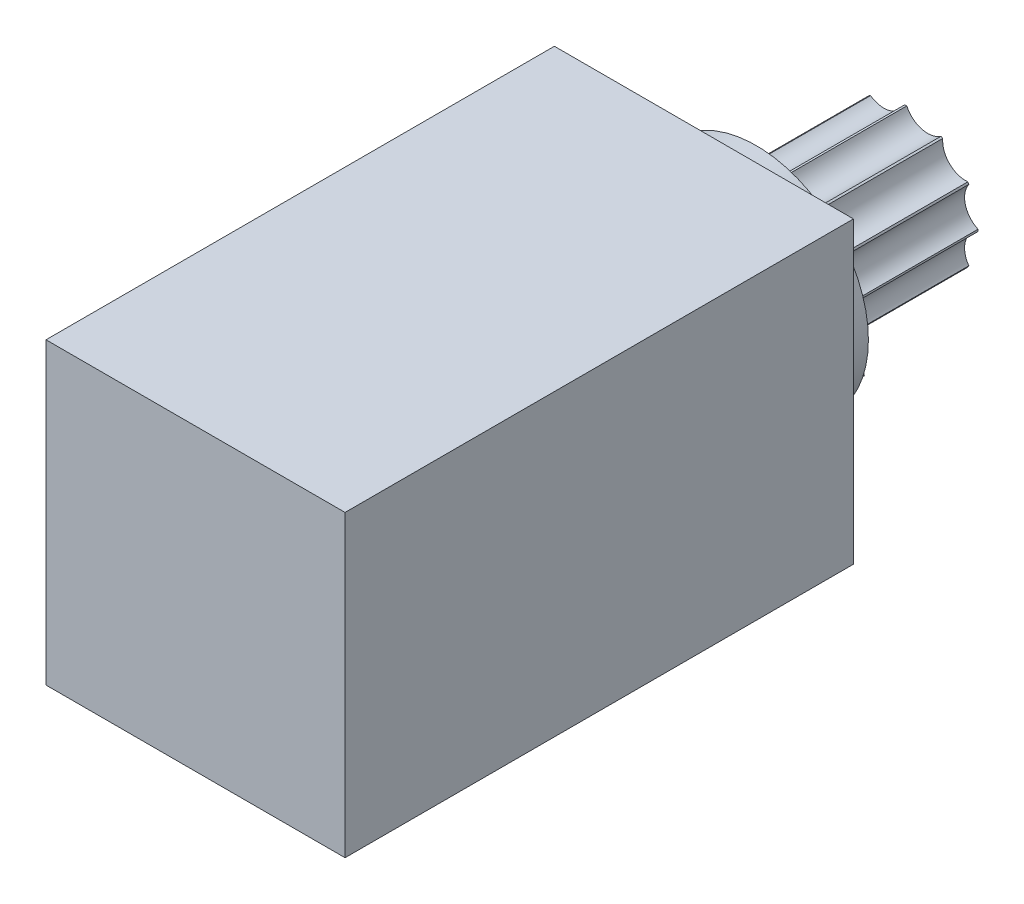
from build123d import *

# Parameters (mm, degrees)
CROQUIS1_R              = 10
SALIENTE_EXTRUIR1_DEPTH = 20
CROQUIS2_R              = 10
CORTAR_EXTRUIR2_DEPTH   = 20
CROQUIS3_R              = 15
SALIENTE_EXTRUIR2_DEPTH = 5
SALIENTE_EXTRUIR3_START = 5
SALIENTE_EXTRUIR3_DEPTH = 5
CROQUIS6_W              = 40
CROQUIS6_H              = 40
SALIENTE_EXTRUIR4_DEPTH = 70
CROQUIS8_W              = 40
CROQUIS8_H              = 40
CROQUIS8_R              = 11.25
CORTAR_EXTRUIR3_DEPTH   = 2


with BuildPart() as part:
    # Croquis1 → Saliente-Extruir1 (new body)
    with BuildSketch(Plane.XY):
        Circle(CROQUIS1_R)
    extrude(amount=SALIENTE_EXTRUIR1_DEPTH)

    # Croquis2 → Cortar-Extruir2 (cut)
    with BuildSketch(Plane(origin=(0, 0, 0), x_dir=(-1, 0, 0), z_dir=(0, 0, -1))):
        Circle(CROQUIS2_R)
        with BuildLine():
            Line((0.133032496, 9.658342122), (-0.133032496, 9.658342122))
            ThreePointArc((-0.133032496, 9.658342122), (-2.135257122, 7.968888067), (-4.71396154, 8.430885884))
            Line((-4.71396154, 8.430885884), (-4.944380582, 8.297853388))
            ThreePointArc((-4.944380582, 8.297853388), (-5.833630945, 5.833630945), (-8.297853388, 4.944380582))
            Line((-8.297853388, 4.944380582), (-8.430885884, 4.71396154))
            ThreePointArc((-8.430885884, 4.71396154), (-7.968888067, 2.135257122), (-9.658342122, 0.133032496))
            Line((-9.658342122, 0.133032496), (-9.658342122, -0.133032496))
            ThreePointArc((-9.658342122, -0.133032496), (-7.968888067, -2.135257122), (-8.430885884, -4.71396154))
            Line((-8.430885884, -4.71396154), (-8.297853388, -4.944380582))
            ThreePointArc((-8.297853388, -4.944380582), (-5.833630945, -5.833630945), (-4.944380582, -8.297853388))
            Line((-4.944380582, -8.297853388), (-4.71396154, -8.430885884))
            ThreePointArc((-4.71396154, -8.430885884), (-2.135257122, -7.968888067), (-0.133032496, -9.658342122))
            Line((-0.133032496, -9.658342122), (0.133032496, -9.658342122))
            ThreePointArc((0.133032496, -9.658342122), (2.135257122, -7.968888067), (4.71396154, -8.430885884))
            Line((4.71396154, -8.430885884), (4.944380582, -8.297853388))
            ThreePointArc((4.944380582, -8.297853388), (5.833630945, -5.833630945), (8.297853388, -4.944380582))
            Line((8.297853388, -4.944380582), (8.430885884, -4.71396154))
            ThreePointArc((8.430885884, -4.71396154), (7.968888067, -2.135257122), (9.658342122, -0.133032496))
            Line((9.658342122, -0.133032496), (9.658342122, 0.133032496))
            ThreePointArc((9.658342122, 0.133032496), (7.968888067, 2.135257122), (8.430885884, 4.71396154))
            Line((8.430885884, 4.71396154), (8.297853388, 4.944380582))
            ThreePointArc((8.297853388, 4.944380582), (5.833630945, 5.833630945), (4.944380582, 8.297853388))
            Line((4.944380582, 8.297853388), (4.71396154, 8.430885884))
            ThreePointArc((4.71396154, 8.430885884), (2.135257122, 7.968888067), (0.133032496, 9.658342122))
        make_face(mode=Mode.SUBTRACT)
    extrude(amount=-CORTAR_EXTRUIR2_DEPTH, mode=Mode.SUBTRACT)

    # Croquis3 → Saliente-Extruir2 (add)
    with BuildSketch(Plane.XY.offset(20)):
        Circle(CROQUIS3_R)
    extrude(amount=SALIENTE_EXTRUIR2_DEPTH)

    # Croquis4 → Saliente-Extruir3 (add)
    with BuildSketch(Plane(origin=(0, 0, 20), x_dir=(-1, 0, 0), z_dir=(0, 0, -1)).offset(SALIENTE_EXTRUIR3_START)):
        Polygon((-9.44954411, -9.44954411), (-6.621116985, -6.621116985), (-8.297853388, -4.944380582), align=None)
        Polygon((-9.44954411, -9.44954411), (-4.944380582, -8.297853388), (-6.621116985, -6.621116985), align=None)
        with BuildLine():
            Line((-4.944380582, -8.297853388), (-8.297853388, -4.944380582))
            ThreePointArc((-8.297853388, -4.944380582), (-5.833630945, -5.833630945), (-4.944380582, -8.297853388))
        make_face()
    extrude(amount=-SALIENTE_EXTRUIR3_DEPTH)

    # Croquis6 → Saliente-Extruir4 (add)
    with BuildSketch(Plane.XY.offset(25)):
        Rectangle(CROQUIS6_W, CROQUIS6_H)
    extrude(amount=SALIENTE_EXTRUIR4_DEPTH)

    # Croquis8 → Cortar-Extruir3 (cut)
    with BuildSketch(Plane(origin=(0, 0, 25), x_dir=(-1, 0, 0), z_dir=(0, 0, -1))):
        Rectangle(CROQUIS8_W, CROQUIS8_H)
        Circle(CROQUIS8_R, mode=Mode.SUBTRACT)
    extrude(amount=-CORTAR_EXTRUIR3_DEPTH, mode=Mode.SUBTRACT)


solid = part.part
